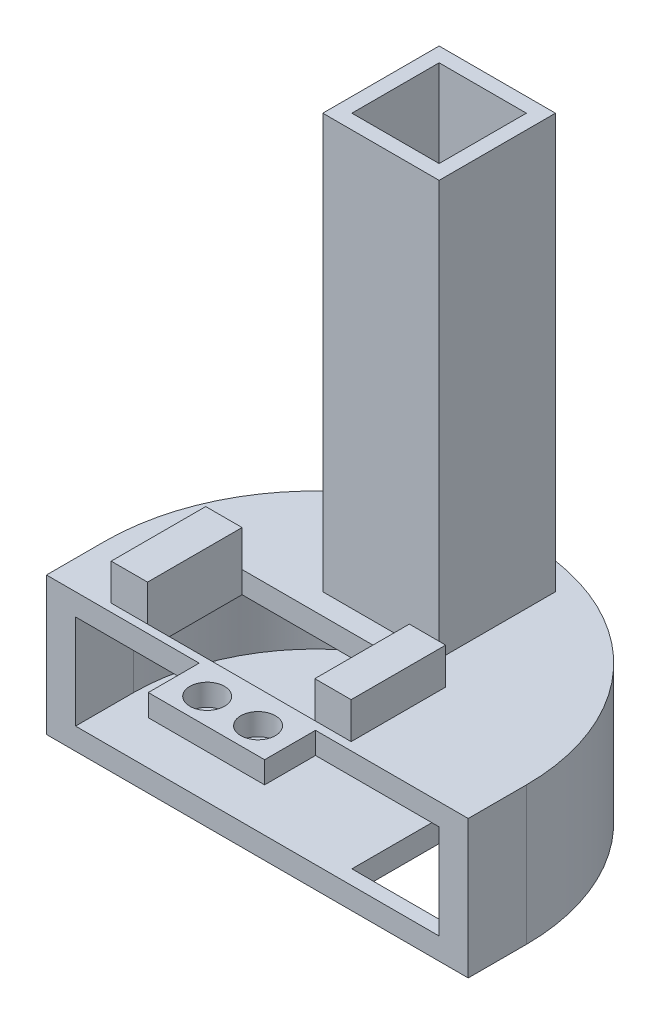
from build123d import *

# Parameters (mm, degrees)
BOSS_EXTRUDE1_DEPTH = 16
SKETCH2_5_W         = 12
SKETCH2_5_H         = 12
BOSS_EXTRUDE2_DEPTH = 3
SKETCH3_W           = 23
SKETCH3_H           = 13
SKETCH3_W_2         = 12
SKETCH3_H_2         = 12
SKETCH3_R           = 2.38125
BOSS_EXTRUDE3_DEPTH = 3
SKETCH3_4_W         = 16
SKETCH3_4_H         = 16
SKETCH3_4_W_2       = 12
SKETCH3_4_H_2       = 12
BOSS_EXTRUDE4_DEPTH = 60
SKETCH3_5_W         = 5
SKETCH3_5_H         = 13
BOSS_EXTRUDE5_DEPTH = 8


with BuildPart() as part:
    # Sketch2 → Boss-Extrude1 (new body)
    with BuildSketch(Plane(origin=(0, 0, 0), x_dir=(1, 0, 0), z_dir=(0, 1, 0))):
        with BuildLine():
            Line((25, 8), (25, 0))
            Line((25, 0), (29, 0))
            Line((29, 0), (29, 8))
            ThreePointArc((29, 8), (0, 37), (-29, 8))
            Line((-29, 8), (-29, 0))
            Line((-29, 0), (-25, 0))
            Line((-25, 0), (-25, 8))
            ThreePointArc((-25, 8), (0, 33), (25, 8))
        make_face()
    extrude(amount=BOSS_EXTRUDE1_DEPTH)

    # Sketch2<5> → Boss-Extrude2 (add)
    with BuildSketch(Plane(origin=(0, 0, 0), x_dir=(1, 0, 0), z_dir=(0, 1, 0))):
        with BuildLine():
            Line((-25, 0), (25, 0))
            Line((25, 0), (25, 8))
            ThreePointArc((25, 8), (0, 33), (-25, 8))
            Line((-25, 8), (-25, 0))
        make_face()
        with Locations((17, 8)):
            Rectangle(SKETCH2_5_W, SKETCH2_5_H, mode=Mode.SUBTRACT)
    extrude(amount=BOSS_EXTRUDE2_DEPTH)

    # Sketch3 → Boss-Extrude3 (add)
    with BuildSketch(Plane(origin=(0, 16, 0), x_dir=(1, 0, 0), z_dir=(0, 1, 0))):
        with BuildLine():
            Line((-29, 8), (-29, 0))
            Line((-29, 0), (-8, 0))
            Line((-8, 0), (-8, -7))
            Line((-8, -7), (8, -7))
            Line((8, -7), (8, 0))
            Line((8, 0), (29, 0))
            Line((29, 0), (29, 8))
            ThreePointArc((29, 8), (0, 37), (-29, 8))
        make_face()
        with Locations((-4.7, 7.6)):
            Rectangle(SKETCH3_W, SKETCH3_H, mode=Mode.SUBTRACT)
        with Locations((0, 25)):
            Rectangle(SKETCH3_W_2, SKETCH3_H_2, mode=Mode.SUBTRACT)
        with Locations((3.5, -3.4)):
            Circle(SKETCH3_R, mode=Mode.SUBTRACT)
        with Locations((-3.5, -3.4)):
            Circle(SKETCH3_R, mode=Mode.SUBTRACT)
    extrude(amount=BOSS_EXTRUDE3_DEPTH)

    # Sketch3<4> → Boss-Extrude4 (add)
    with BuildSketch(Plane(origin=(0, 16, 0), x_dir=(1, 0, 0), z_dir=(0, 1, 0))):
        with Locations((0, 25)):
            Rectangle(SKETCH3_4_W, SKETCH3_4_H)
        with Locations((0, 25)):
            Rectangle(SKETCH3_4_W_2, SKETCH3_4_H_2, mode=Mode.SUBTRACT)
    extrude(amount=BOSS_EXTRUDE4_DEPTH)

    # Sketch3<5> → Boss-Extrude5 (add)
    with BuildSketch(Plane(origin=(0, 16, 0), x_dir=(1, 0, 0), z_dir=(0, 1, 0))):
        with Locations((-18.7, 7.6)):
            Rectangle(SKETCH3_5_W, SKETCH3_5_H)
        Polygon((9, 14.1), (6.8, 14.1), (6.8, 1.1), (11.8, 1.1), (11.8, 14.1), align=None)
    extrude(amount=BOSS_EXTRUDE5_DEPTH)


solid = part.part
